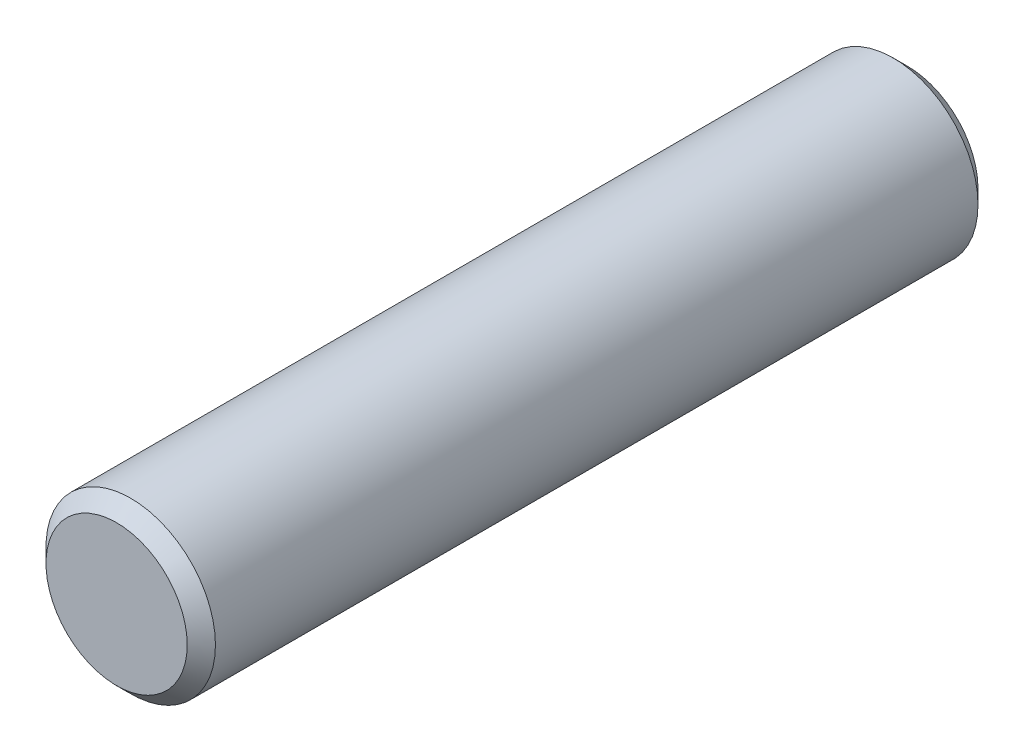
from build123d import *

# Parameters (mm, degrees)
SKETCH2_R           = 19.05
BOSS_EXTRUDE1_DEPTH = 88.9
CHAMFER1_SIZE       = 3.175


with BuildPart() as part:
    # Sketch2 → Boss-Extrude1 (new, symmetric)
    with BuildSketch(Plane.XY):
        Circle(SKETCH2_R)
    extrude(amount=BOSS_EXTRUDE1_DEPTH, both=True)

    # Chamfer1
    chamfer1_edges = [part.edges().sort_by_distance(p)[0] for p in [
        (-19.05, 0, -88.9),
        (-19.05, 0, 88.9),
    ]]
    chamfer(chamfer1_edges, length=CHAMFER1_SIZE)


solid = part.part
